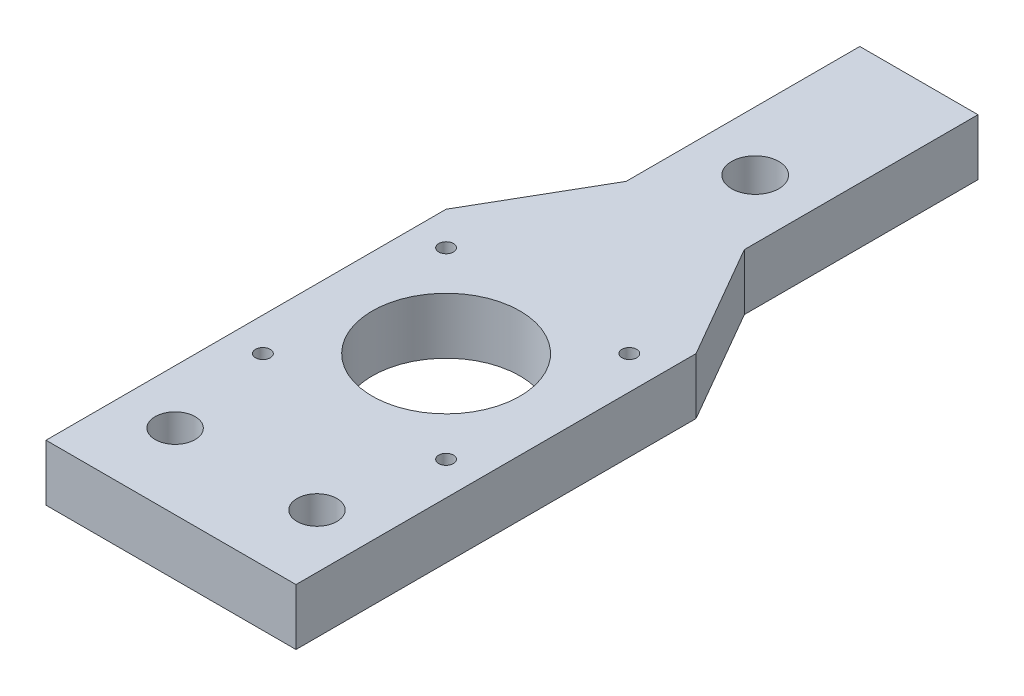
from build123d import *

# Parameters (mm, degrees)
SKETCH2_R                   = 4
BOSS_EXTRUDE1_DEPTH         = 9.525
TAP_DRILL_FOR_M3X0_5_TAP1_D = 2.5
SKETCH7_W                   = 42.3
SKETCH7_H                   = 25.4
BOSS_EXTRUDE2_DEPTH         = 9.525
F_1_4_CLEARANCE_HOLE1_D     = 6.7564


with BuildPart() as part:
    # Sketch2 → Boss-Extrude1 (new body)
    # profile 1 of 6: a face of its own
    with BuildSketch(Plane(origin=(0, 0, 0), x_dir=(1, 0, 0), z_dir=(0, 1, 0))):
        Polygon((20, 0), (0, 0), (0, -39.537633496), (0, -58.85), (20, -58.85), (20, -39.537633496), align=None)
        with Locations(Location((10, -27.7, 0), (0, 0, 90))):
            Circle(SKETCH2_R, mode=Mode.SUBTRACT)
    # profile 2 of 6: a face of its own
    with BuildSketch(Plane(origin=(0, 0, 0), x_dir=(1, 0, 0), z_dir=(0, 1, 0))):
        Polygon((0, -58.85), (0, -39.537633496), (-11.15, -58.85), align=None)
    # profile 3 of 6: a face of its own
    with BuildSketch(Plane(origin=(0, 0, 0), x_dir=(1, 0, 0), z_dir=(0, 1, 0))):
        Polygon((31.15, -58.85), (20, -39.537633496), (20, -58.85), align=None)
    # profile 4 of 6: a face of its own
    with BuildSketch(Plane(origin=(0, 0, 0), x_dir=(1, 0, 0), z_dir=(0, 1, 0))):
        with BuildLine():
            Line((0, -72.5), (0, -58.85))
            Line((0, -58.85), (-11.15, -58.85))
            Line((-11.15, -58.85), (-11.15, -101.15))
            Line((-11.15, -101.15), (31.15, -101.15))
            Line((31.15, -101.15), (31.15, -58.85))
            Line((31.15, -58.85), (20, -58.85))
            Line((20, -58.85), (20, -72.5))
            ThreePointArc((20, -72.5), (21.858541226, -76.047152925), (22.5, -80))
            ThreePointArc((22.5, -80), (21.858541226, -83.952847075), (20, -87.5))
            Line((20, -87.5), (20, -100))
            Line((20, -100), (0, -100))
            Line((0, -100), (0, -87.5))
            ThreePointArc((0, -87.5), (-2.5, -80), (0, -72.5))
        make_face()
    # profile 5 of 6: a face of its own
    with BuildSketch(Plane(origin=(0, 0, 0), x_dir=(1, 0, 0), z_dir=(0, 1, 0))):
        with BuildLine():
            Line((20, -58.85), (0, -58.85))
            Line((0, -58.85), (0, -72.5))
            ThreePointArc((0, -72.5), (10, -67.5), (20, -72.5))
            Line((20, -72.5), (20, -58.85))
        make_face()
    # profile 6 of 6: a face of its own
    with BuildSketch(Plane(origin=(0, 0, 0), x_dir=(1, 0, 0), z_dir=(0, 1, 0))):
        with BuildLine():
            ThreePointArc((20, -87.5), (10, -92.5), (0, -87.5))
            Line((0, -87.5), (0, -100))
            Line((0, -100), (20, -100))
            Line((20, -100), (20, -87.5))
        make_face()
    extrude(amount=BOSS_EXTRUDE1_DEPTH)

    # Tap Drill for M3x0.5 Tap1 (through all)
    with Locations(Plane(origin=(0, 9.525, 0), x_dir=(1, 0, 0), z_dir=(0, 1, 0))):
        with Locations((-5.5, -64.5), (25.5, -64.5), (25.5, -95.5), (-5.5, -95.5)):
            Hole(TAP_DRILL_FOR_M3X0_5_TAP1_D / 2)

    # Sketch7 → Boss-Extrude2 (add)
    with BuildSketch(Plane(origin=(0, 9.525, 0), x_dir=(1, 0, 0), z_dir=(0, 1, 0))):
        with Locations((10, -113.85)):
            Rectangle(SKETCH7_W, SKETCH7_H)
    extrude(amount=-BOSS_EXTRUDE2_DEPTH)

    # 1/4 Clearance Hole1 (through all)
    with Locations(Plane(origin=(0, 9.525, 0), x_dir=(1, 0, 0), z_dir=(0, 1, 0))):
        with Locations((-2, -113.85), (22, -113.85)):
            Hole(F_1_4_CLEARANCE_HOLE1_D / 2)


solid = part.part
